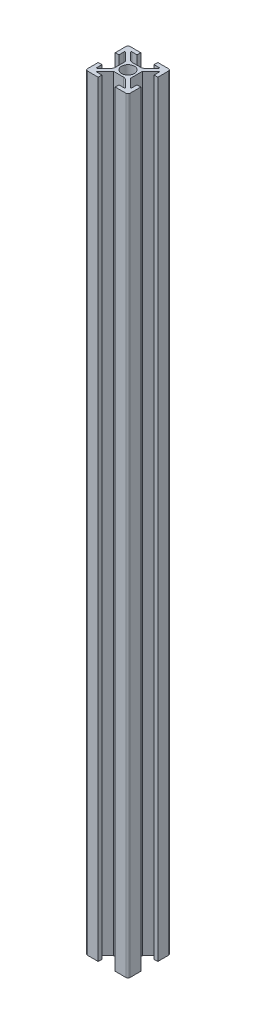
from build123d import *

# Parameters (mm, degrees)
ESBO_O1_W                = 20
ESBO_O1_H                = 20
ESBO_O1_R                = 3
RESSALTO_EXTRUS_O1_DEPTH = 180
ESBO_O2_W                = 8
ESBO_O2_H                = 1.75
CORTE_EXTRUS_O1_DEPTH    = 361.277670693
PADR_OCIRCULAR2_COUNT    = 4
FILETE2_R                = 1
FILETE3_R                = 2
FILETE4_R                = 0.25


with BuildPart() as part:
    # Esboço1 → Ressalto-extrusão1 (new, symmetric)
    with BuildSketch(Plane(origin=(0, 0, 0), x_dir=(1, 0, 0), z_dir=(0, 1, 0))):
        Rectangle(ESBO_O1_W, ESBO_O1_H)
        with Locations(Location((0, 0, 0), (0, 0, 90))):
            Circle(ESBO_O1_R, mode=Mode.SUBTRACT)
    extrude(amount=RESSALTO_EXTRUS_O1_DEPTH, both=True)

    # Esboço2 → Corte-extrusão1 (cut, through all)
    with BuildSketch(Plane(origin=(0, 180, 0), x_dir=(1, 0, 0), z_dir=(0, 1, 0))):
        Polygon((-7.05, 8.25), (-2.8, 4), (2.8, 4), (7.05, 8.25), (4, 8.25), (-4, 8.25), align=None)
        with Locations((0, 9.125)):
            Rectangle(ESBO_O2_W, ESBO_O2_H)
    corte_extrus_o1 = extrude(amount=-CORTE_EXTRUS_O1_DEPTH, mode=Mode.SUBTRACT)

    # PadrãoCircular2: Corte-extrusão1 ×4 about axis
    padr_ocircular2_axis = Axis((0, 0, 0), (0, 1, 0))
    for i in range(1, PADR_OCIRCULAR2_COUNT):
        add(corte_extrus_o1.rotate(padr_ocircular2_axis, i * 360 / PADR_OCIRCULAR2_COUNT), mode=Mode.SUBTRACT)

    # Filete2
    filete2_edges = [part.edges().sort_by_distance(p)[0] for p in [
        (10, 0, 10),
        (-10, 0, 10),
        (-10, 0, -10),
        (10, 0, -10),
    ]]
    fillet(filete2_edges, radius=FILETE2_R)

    # Filete3
    filete3_edges = [part.edges().sort_by_distance(p)[0] for p in [
        (-4, 0, 2.8),
        (2.8, 0, -4),
        (-2.8, 0, -4),
        (2.8, 0, 4),
    ]]
    fillet(filete3_edges, radius=FILETE3_R)

    # Filete4
    filete4_edges = [part.edges().sort_by_distance(p)[0] for p in [
        (-8.25, 0, -7.05),
        (-8.25, 0, 7.05),
        (7.05, 0, -8.25),
        (-7.05, 0, -8.25),
        (8.25, 0, 7.05),
        (8.25, 0, -7.05),
        (-7.05, 0, 8.25),
        (7.05, 0, 8.25),
    ]]
    fillet(filete4_edges, radius=FILETE4_R)


solid = part.part
